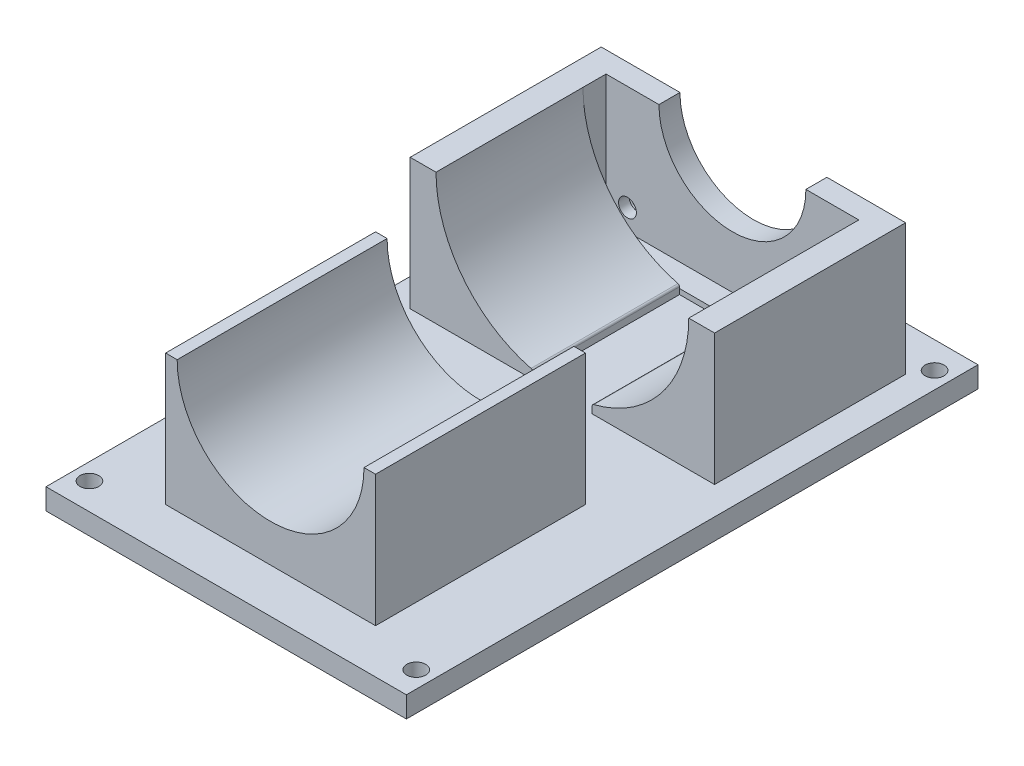
from build123d import *

# Parameters (mm, degrees)
SKETCH1_W           = 72.5
SKETCH1_H           = 72.5
SKETCH1_R           = 17.5
SKETCH1_R_2         = 2.125
BOSS_EXTRUDE1_DEPTH = 5
BOSS_EXTRUDE2_DEPTH = 50
SKETCH18_R          = 5
CUT_EXTRUDE1_DEPTH  = 2.5
BOSS_EXTRUDE3_DEPTH = 5.5
SKETCH8_W           = 72.5
SKETCH8_H           = 5
BOSS_EXTRUDE4_DEPTH = 54.5
BOSS_EXTRUDE5_DEPTH = 35
BOSS_EXTRUDE7_DEPTH = 1.25
SKETCH12_W          = 85.832523084
SKETCH12_H          = 136.148140064
SKETCH12_R          = 2.25
BOSS_EXTRUDE6_DEPTH = 5
FILLET10_R          = 0.5
SKETCH26_W          = 72.5
SKETCH26_H          = 36.25
CUT_EXTRUDE3_DEPTH  = 166.204098106


with BuildPart() as part:
    # Sketch1 → Boss-Extrude1 (new body)
    with BuildSketch(Plane.XY):
        with Locations((36.25, 36.25)):
            Rectangle(SKETCH1_W, SKETCH1_H)
        with Locations((36.25, 36.25)):
            Circle(SKETCH1_R, mode=Mode.SUBTRACT)
        with Locations((11.25, 61.25)):
            Circle(SKETCH1_R_2, mode=Mode.SUBTRACT)
        with Locations((61.25, 61.25)):
            Circle(SKETCH1_R_2, mode=Mode.SUBTRACT)
        with Locations((61.25, 11.25)):
            Circle(SKETCH1_R_2, mode=Mode.SUBTRACT)
        with Locations((11.25, 11.25)):
            Circle(SKETCH1_R_2, mode=Mode.SUBTRACT)
    extrude(amount=BOSS_EXTRUDE1_DEPTH)

    # Sketch18 → Cut-Extrude1 (cut)
    with BuildSketch(Plane.XY):
        with Locations((61.25, 61.25)):
            Circle(SKETCH18_R)
        with Locations((11.25, 61.25)):
            Circle(SKETCH18_R)
        with Locations((61.25, 11.25)):
            Circle(SKETCH18_R)
        with Locations((11.25, 11.25)):
            Circle(SKETCH18_R)
    extrude(amount=CUT_EXTRUDE1_DEPTH, mode=Mode.SUBTRACT)

    # Sketch7 → Boss-Extrude3 (add)
    with BuildSketch(Plane.XY.offset(5)):
        Polygon((0, 0), (72.5, 0), (72.5, 36.25), (66.35, 36.25), (66.35, 5), (6.15, 5), (6.15, 36.25), (0, 36.25), align=None)
    extrude(amount=BOSS_EXTRUDE3_DEPTH)



with BuildPart() as body_2:
    # Sketch5 → Boss-Extrude2 (new body)
    with BuildSketch(Plane.XY.offset(65)):
        with BuildLine():
            Line((0, 0), (72.5, 0))
            Line((72.5, 0), (72.5, 5))
            Line((72.5, 5), (61.25, 5))
            Line((61.25, 5), (61.25, 36.25))
            Line((61.25, 36.25), (58.5, 36.25))
            ThreePointArc((58.5, 36.25), (36.25, 14), (14, 36.25))
            Line((14, 36.25), (11.25, 36.25))
            Line((11.25, 36.25), (11.25, 5))
            Line((11.25, 5), (0, 5))
            Line((0, 5), (0, 0))
        make_face()
    extrude(amount=BOSS_EXTRUDE2_DEPTH)


with BuildPart() as part_1:
    add(part.part)

    add(body_2.part)  # Boss-Extrude4 merges body 2
    # Sketch8 → Boss-Extrude4 (add)
    with BuildSketch(Plane.XY.offset(65)):
        with Locations((36.25, 2.5)):
            Rectangle(SKETCH8_W, SKETCH8_H)
    extrude(amount=-BOSS_EXTRUDE4_DEPTH)

    # Sketch11 → Boss-Extrude5 (add)
    with BuildSketch(Plane.XY.offset(10.5)):
        with BuildLine():
            Line((0, 5), (29.147359646, 5))
            Line((29.147359646, 5), (29.147359646, 7))
            ThreePointArc((29.147359646, 7), (12.587799398, 17.645961119), (6.15, 36.25))
            Line((6.15, 36.25), (0, 36.25))
            Line((0, 36.25), (0, 5))
        make_face()
        with BuildLine():
            Line((72.5, 5), (43.352640354, 5))
            Line((43.352640354, 5), (43.352640354, 7))
            ThreePointArc((43.352640354, 7), (59.912200602, 17.645961119), (66.35, 36.25))
            Line((66.35, 36.25), (72.5, 36.25))
            Line((72.5, 36.25), (72.5, 5))
        make_face()
    extrude(amount=BOSS_EXTRUDE5_DEPTH)

    # Sketch17 → Boss-Extrude7 (add)
    with BuildSketch(Plane(origin=(0, 5, 0), x_dir=(1, 0, 0), z_dir=(0, 1, 0))):
        Polygon((6.15, -5), (6.15, -10.5), (66.465854546, -10.5), (66.35, -5), align=None)
    extrude(amount=BOSS_EXTRUDE7_DEPTH)

    # Sketch12 → Boss-Extrude6 (add)
    with BuildSketch(Plane(origin=(0, 0, 0), x_dir=(1, 0, 0), z_dir=(0, 1, 0))):
        with Locations((36.25, -57.5)):
            Rectangle(SKETCH12_W, SKETCH12_H)
        with Locations(Location((-2.666504617, 4.229628013, 0), (0, 0, 90))):
            Circle(SKETCH12_R, mode=Mode.SUBTRACT)
        with Locations(Location((75.166504617, 4.229628013, 0), (0, 0, 90))):
            Circle(SKETCH12_R, mode=Mode.SUBTRACT)
        with Locations(Location((75.166504617, -119.229628013, 0), (0, 0, 90))):
            Circle(SKETCH12_R, mode=Mode.SUBTRACT)
        with Locations(Location((-2.666504617, -119.229628013, 0), (0, 0, 90))):
            Circle(SKETCH12_R, mode=Mode.SUBTRACT)
    extrude(amount=BOSS_EXTRUDE6_DEPTH)

    # Fillet10
    fillet10_edges = [part_1.edges().sort_by_distance(p)[0] for p in [
        (29.147359646, 7, 28),
        (43.352640354, 7, 28),
    ]]
    fillet(fillet10_edges, radius=FILLET10_R)

    # Sketch26 → Cut-Extrude3 (cut, through all)
    with BuildSketch(Plane.XY):
        with Locations((36.25, 54.375)):
            Rectangle(SKETCH26_W, SKETCH26_H)
    extrude(amount=CUT_EXTRUDE3_DEPTH, mode=Mode.SUBTRACT)


solid = part_1.part
